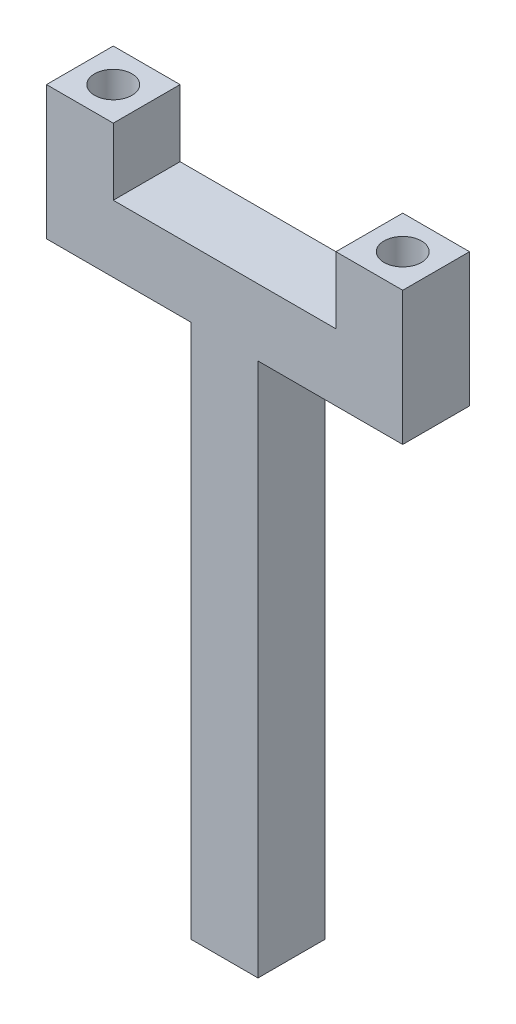
from build123d import *

# Parameters (mm, degrees)
BOSS_EXTRUDE1_DEPTH = 7.5
SKETCH3_R           = 2.1
CUT_EXTRUDE1_DEPTH  = 5


with BuildPart() as part:
    # Sketch1 → Boss-Extrude1 (new body)
    with BuildSketch(Plane.XY):
        Polygon((12.5, 75), (20, 75), (20, 60), (3.75, 60), (3.75, 0), (-3.75, 0), (-3.75, 60), (-20, 60), (-20, 75), (-12.5, 75), (-12.5, 67.5), (0, 67.5), (12.5, 67.5), align=None)
    extrude(amount=BOSS_EXTRUDE1_DEPTH)

    # Sketch3 → Cut-Extrude1 (cut)
    with BuildSketch(Plane(origin=(0, 75, 0), x_dir=(1, 0, 0), z_dir=(0, 1, 0))):
        with Locations(Location((-16.25, -3.75, 0), (0, 0, 270))):
            Circle(SKETCH3_R)
        with Locations(Location((16.25, -3.75, 0), (0, 0, 270))):
            Circle(SKETCH3_R)
    extrude(amount=-CUT_EXTRUDE1_DEPTH, mode=Mode.SUBTRACT)


solid = part.part
